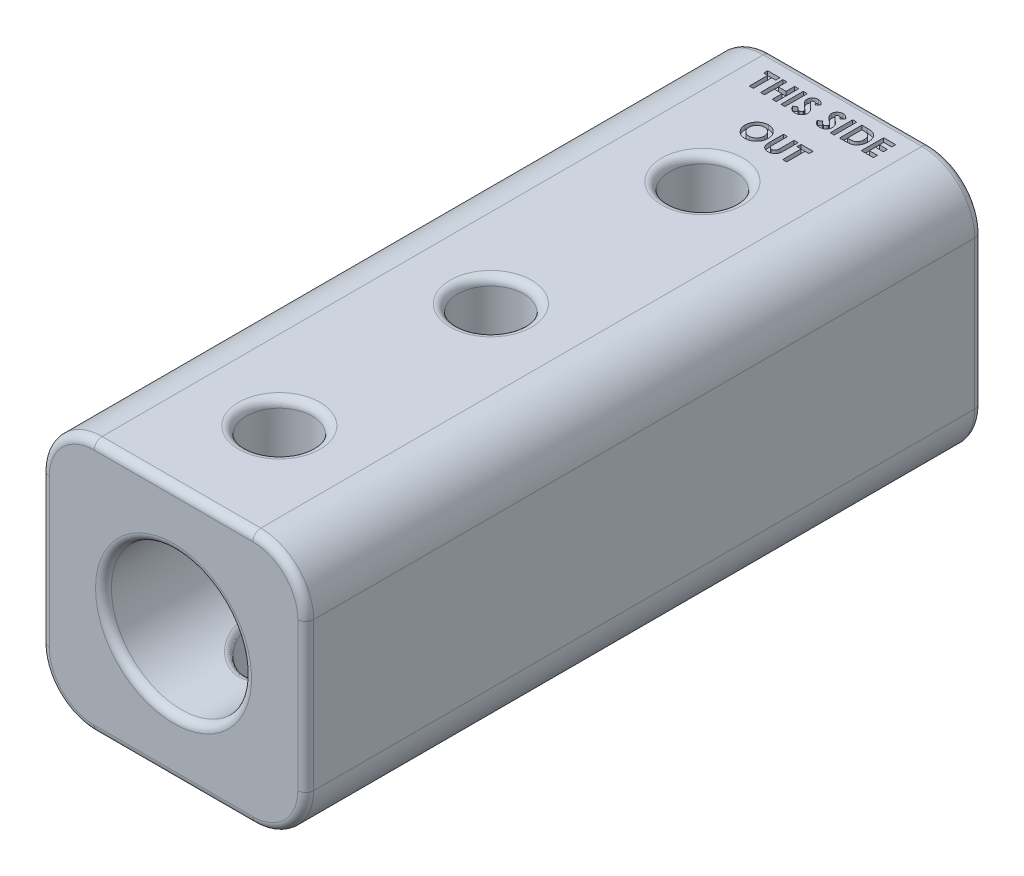
from build123d import *

# Parameters (mm, degrees)
SKETCH1_W           = 25
SKETCH1_H           = 24
SKETCH1_R           = 6.625
BOSS_EXTRUDE1_DEPTH = 32
SKETCH2_R           = 3.1
CUT_EXTRUDE1_DEPTH  = 42.907636536
FILLET1_R           = 5
FILLET2_R           = 0.75
SKETCH3_W           = 0.37991453
SKETCH3_H           = 2.116666666
CUT_EXTRUDE2_DEPTH  = 0.4


with BuildPart() as part:
    # Sketch1 → Boss-Extrude1 (new, symmetric)
    with BuildSketch(Plane.XY):
        Rectangle(SKETCH1_W, SKETCH1_H)
        Circle(SKETCH1_R, mode=Mode.SUBTRACT)
    extrude(amount=BOSS_EXTRUDE1_DEPTH, both=True)

    # Sketch2 → Cut-Extrude1 (cut, through all)
    with BuildSketch(Plane(origin=(0, 12, 0), x_dir=(1, 0, 0), z_dir=(0, 1, 0))):
        with Locations(Location((0, -22, 0), (0, 0, 270))):
            Circle(SKETCH2_R)
        with Locations(Location((0, -2, 0), (0, 0, 270))):
            Circle(SKETCH2_R)
        with Locations(Location((0, 18, 0), (0, 0, 270))):
            Circle(SKETCH2_R)
    extrude(amount=-CUT_EXTRUDE1_DEPTH, mode=Mode.SUBTRACT)

    # Fillet1
    fillet1_edges = [part.edges().sort_by_distance(p)[0] for p in [
        (12.5, -12, 0),
        (-12.5, -12, 0),
        (-12.5, 12, 0),
        (12.5, 12, 0),
    ]]
    fillet(fillet1_edges, radius=FILLET1_R)

    # Fillet2
    fillet2_edges = [part.edges().sort_by_distance(p)[0] for p in [
        (-6.625, 0, -32),
        (-6.625, 0, 32),
        (0, 6.625, 18.899999999),
        (0, -6.625, 18.899999999),
        (0, -12, 18.9),
        (0, 12, 18.9),
        (0, 6.625, -1.100000001),
        (0, -6.625, -1.100000001),
        (0, -12, -1.1),
        (0, 12, -1.1),
        (0, 6.625, -21.100000001),
        (0, -6.625, -21.100000001),
        (0, -12, -21.1),
        (0, 12, -21.1),
        (12.5, 0, -32),
        (12.5, 0, 32),
        (0, -12, -32),
        (-12.5, 0, -32),
        (0, 12, -32),
        (11.035533906, 10.535533906, -32),
        (-11.035533906, 10.535533906, -32),
        (-11.035533906, -10.535533906, -32),
        (11.035533906, -10.535533906, -32),
        (0, -12, 32),
        (0, 12, 32),
        (-12.5, 0, 32),
        (11.035533906, 10.535533906, 32),
        (-11.035533906, 10.535533906, 32),
        (-11.035533906, -10.535533906, 32),
        (11.035533906, -10.535533906, 32),
    ]]
    fillet(fillet2_edges, radius=FILLET2_R)

    # Sketch3 → Cut-Extrude2 (cut)
    # profile 1 of 11: a face of its own
    with BuildSketch(Plane(origin=(0, 12, 0), x_dir=(1, 0, 0), z_dir=(0, 1, 0))):
        Polygon((-5.97929219, 30.156200498), (-4.839548601, 30.156200498), (-4.839548601, 29.776285968), (-5.219463131, 29.776285968), (-5.219463131, 28.039533832), (-5.59937766, 28.039533832), (-5.59937766, 29.776285968), (-5.97929219, 29.776285968), align=None)
    # profile 2 of 11: a face of its own
    with BuildSketch(Plane(origin=(0, 12, 0), x_dir=(1, 0, 0), z_dir=(0, 1, 0))):
        Polygon((-4.541044327, 30.156200498), (-4.161129797, 30.156200498), (-4.161129797, 29.342097934), (-3.428437489, 29.342097934), (-3.428437489, 30.156200498), (-3.04852296, 30.156200498), (-3.04852296, 28.039533832), (-3.428437489, 28.039533832), (-3.428437489, 28.962183404), (-4.161129797, 28.962183404), (-4.161129797, 28.039533832), (-4.541044327, 28.039533832), align=None)
    # profile 3 of 11: a face of its own
    with BuildSketch(Plane(origin=(0, 12, 0), x_dir=(1, 0, 0), z_dir=(0, 1, 0))):
        with Locations((-2.42437766, 29.097867165)):
            Rectangle(SKETCH3_W, SKETCH3_H)
    # profile 4 of 11: a face of its own
    with BuildSketch(Plane(origin=(0, 12, 0), x_dir=(1, 0, 0), z_dir=(0, 1, 0))):
        with BuildLine():
            Line((-0.660488772, 29.87338466), (-0.944576645, 29.613465456))
            add(Edge.make_bspline(
                [(-0.944576645, 29.613465456), (-0.956745752, 29.630631245), (-0.980108739, 29.663587168), (-1.017977704, 29.707715924), (-1.055675672, 29.745361038), (-1.093551891, 29.776365244), (-1.131942081, 29.80054017), (-1.170779602, 29.817656284), (-1.209844274, 29.828537161), (-1.236089704, 29.829892092), (-1.249017084, 29.830559473)],
                knots=[0, 0, 0, 0, 1.299362458, 2.494594718, 3.587462134, 4.587049575, 5.512617175, 6.380583204, 7.202344345, 8, 8, 8, 8], degree=3))
            add(Edge.make_bspline(
                [(-1.249017084, 29.830559473), (-1.261075372, 29.830136589), (-1.28435676, 29.829320113), (-1.317546105, 29.821204396), (-1.347012078, 29.807197861), (-1.372725921, 29.788883138), (-1.39309508, 29.766818143), (-1.409358273, 29.743677636), (-1.418515817, 29.718135751), (-1.41972113, 29.700592553), (-1.420317831, 29.69190763)],
                knots=[0, 0, 0, 0, 1.185010067, 2.2879431, 3.333075148, 4.379039566, 5.372662701, 6.27520591, 7.14612461, 8, 8, 8, 8], degree=3))
            add(Edge.make_bspline(
                [(-1.420317831, 29.69190763), (-1.419943909, 29.683097466), (-1.419190881, 29.66535502), (-1.411917655, 29.639351256), (-1.400954827, 29.613942552), (-1.390479397, 29.598475064), (-1.385124856, 29.590568821)],
                knots=[0, 0, 0, 0, 0.967525499, 1.948461899, 2.951351359, 4, 4, 4, 4], degree=3))
            add(Edge.make_bspline(
                [(-1.385124856, 29.590568821), (-1.380256999, 29.584423381), (-1.369051835, 29.570277389), (-1.347685881, 29.547872343), (-1.320854731, 29.5204242), (-1.287525865, 29.488876822), (-1.249082856, 29.452095641), (-1.20374382, 29.411526541), (-1.152813814, 29.365913142), (-1.116613945, 29.334149623), (-1.097644888, 29.317505253)],
                knots=[0, 0, 0, 0, 0.473873513, 1.090794244, 1.870441696, 2.795289791, 3.865433203, 5.087734844, 6.473946851, 8, 8, 8, 8], degree=3))
            add(Edge.make_bspline(
                [(-1.097644888, 29.317505253), (-1.079839699, 29.30209576), (-1.046049151, 29.272851744), (-0.99797191, 29.23134456), (-0.955720022, 29.194001558), (-0.918677975, 29.161383177), (-0.887407288, 29.133147176), (-0.8617765, 29.109158587), (-0.841472575, 29.089884424), (-0.829930982, 29.078242817), (-0.825005331, 29.073274483)],
                knots=[0, 0, 0, 0, 1.543621617, 2.929473131, 4.163658386, 5.240097082, 6.164993805, 6.925417477, 7.541396219, 8, 8, 8, 8], degree=3))
            add(Edge.make_bspline(
                [(-0.825005331, 29.073274483), (-0.80631844, 29.053051265), (-0.770395672, 29.014175136), (-0.723708737, 28.953929363), (-0.685283879, 28.895117204), (-0.655557681, 28.836632013), (-0.63310726, 28.777629965), (-0.617279416, 28.716664039), (-0.607800015, 28.653097177), (-0.60674758, 28.609720554), (-0.606215267, 28.587781027)],
                knots=[0, 0, 0, 0, 1.206664779, 2.319633467, 3.337109185, 4.282041471, 5.190008762, 6.099243693, 7.03861361, 8, 8, 8, 8], degree=3))
            add(Edge.make_bspline(
                [(-0.606215267, 28.587781027), (-0.606594154, 28.566403649), (-0.607337543, 28.524460436), (-0.616442637, 28.463082792), (-0.629425967, 28.404341723), (-0.649500473, 28.348876415), (-0.673967162, 28.295776421), (-0.70463969, 28.245868871), (-0.740660369, 28.19864868), (-0.781945597, 28.154959966), (-0.827611962, 28.115315486), (-0.876593478, 28.080023034), (-0.929369112, 28.05088462), (-0.985487956, 28.026891214), (-1.044919972, 28.008411172), (-1.107594359, 27.994752698), (-1.17360698, 27.986555098), (-1.218747361, 27.985698136), (-1.241808884, 27.985260327)],
                knots=[0, 0, 0, 0, 1.043214005, 2.046824704, 3.02475056, 3.976699089, 4.921714032, 5.875962561, 6.831408892, 7.817874052, 8.806269674, 9.781291748, 10.760897367, 11.74438705, 12.757449933, 13.795994037, 14.874007457, 16, 16, 16, 16], degree=3))
            add(Edge.make_bspline(
                [(-1.241808884, 27.985260327), (-1.259911982, 27.985581488), (-1.2957665, 27.986217571), (-1.348610639, 27.99141066), (-1.399637628, 27.999791752), (-1.448789991, 28.011804361), (-1.496289168, 28.027025966), (-1.542137109, 28.045618573), (-1.58601731, 28.067870361), (-1.628261791, 28.093323744), (-1.668665191, 28.122878475), (-1.707738395, 28.155930317), (-1.745093291, 28.192987621), (-1.780909287, 28.23396275), (-1.814957222, 28.278971733), (-1.848351607, 28.327387739), (-1.879608295, 28.380109303), (-1.898916942, 28.417093906), (-1.90877937, 28.43598482)],
                knots=[0, 0, 0, 0, 1.016823716, 2.013894106, 2.979844003, 3.91962641, 4.853723003, 5.779685073, 6.695824784, 7.614987388, 8.547259901, 9.504950863, 10.487499108, 11.500346958, 12.559593716, 13.656357062, 14.802919212, 16, 16, 16, 16], degree=3))
            Line((-1.90877937, 28.43598482), (-1.574658109, 28.636542379))
            add(Edge.make_bspline(
                [(-1.574658109, 28.636542379), (-1.562321686, 28.615098723), (-1.538671707, 28.573989402), (-1.498594608, 28.518753818), (-1.457537666, 28.471453684), (-1.414551681, 28.432925033), (-1.370159347, 28.402652686), (-1.324146239, 28.381017966), (-1.276480028, 28.3676261), (-1.24401197, 28.365990643), (-1.227816496, 28.365174857)],
                knots=[0, 0, 0, 0, 1.283663364, 2.460892379, 3.537111102, 4.529833553, 5.449777664, 6.316464042, 7.160231139, 8, 8, 8, 8], degree=3))
            add(Edge.make_bspline(
                [(-1.227816496, 28.365174857), (-1.21134338, 28.365841072), (-1.179383135, 28.367133627), (-1.133763976, 28.379072563), (-1.091938604, 28.397817567), (-1.055785061, 28.424564104), (-1.02517252, 28.455433673), (-1.002578707, 28.48977748), (-0.988385122, 28.52693665), (-0.986884516, 28.552749854), (-0.986129797, 28.565732416)],
                knots=[0, 0, 0, 0, 1.13588714, 2.203786484, 3.234766741, 4.283437687, 5.291419208, 6.222934724, 7.106237994, 8, 8, 8, 8], degree=3))
            add(Edge.make_bspline(
                [(-0.986129797, 28.565732416), (-0.986826749, 28.577810578), (-0.98824254, 28.602346207), (-0.998670822, 28.638826742), (-1.014973408, 28.675290686), (-1.034260516, 28.7051994), (-1.053887564, 28.730241155), (-1.072655448, 28.751938703), (-1.095509767, 28.775910695), (-1.122392571, 28.802187286), (-1.152948669, 28.830999796), (-1.1872038, 28.862345403), (-1.225550222, 28.895947989), (-1.252653549, 28.918837739), (-1.266825577, 28.930806535)],
                knots=[0, 0, 0, 0, 0.916159276, 1.861089862, 2.860218735, 3.940849679, 4.552606315, 5.27541173, 6.11797699, 7.06649574, 8.129236253, 9.306560635, 10.591630461, 12, 12, 12, 12], degree=3))
            add(Edge.make_bspline(
                [(-1.266825577, 28.930806535), (-1.293767167, 28.953601704), (-1.345476234, 28.997352532), (-1.418547705, 29.061971129), (-1.484391644, 29.122363129), (-1.54243935, 29.179275108), (-1.593430443, 29.231656036), (-1.637019587, 29.279931368), (-1.672727936, 29.324473485), (-1.710303274, 29.377230641), (-1.746007358, 29.441518861), (-1.776865818, 29.518865042), (-1.796885485, 29.59620141), (-1.79912841, 29.648120787), (-1.800232361, 29.673675124)],
                knots=[0, 0, 0, 0, 1.345494975, 2.582412109, 3.71882943, 4.751509156, 5.681369928, 6.505683931, 7.230279997, 7.856715994, 8.973648664, 10.023341002, 11.027102913, 12, 12, 12, 12], degree=3))
            add(Edge.make_bspline(
                [(-1.800232361, 29.673675124), (-1.799773229, 29.691796889), (-1.79886869, 29.727498712), (-1.790800061, 29.77999304), (-1.778741188, 29.830645656), (-1.761228242, 29.879271756), (-1.738498553, 29.925810434), (-1.710894228, 29.970489516), (-1.677986625, 30.012897786), (-1.640901978, 30.05300713), (-1.600044191, 30.089662507), (-1.556382454, 30.122014549), (-1.510163896, 30.149339555), (-1.461671257, 30.172007631), (-1.410604051, 30.189358603), (-1.357338486, 30.201657837), (-1.301798163, 30.208973029), (-1.264020834, 30.209967445), (-1.244776966, 30.210474003)],
                knots=[0, 0, 0, 0, 1.010766082, 1.991317756, 2.957454644, 3.913069143, 4.869106762, 5.843196583, 6.838735724, 7.860187025, 8.887984031, 9.89767229, 10.887916223, 11.879572884, 12.879850636, 13.892031539, 14.926195476, 16, 16, 16, 16], degree=3))
            add(Edge.make_bspline(
                [(-1.244776966, 30.210474003), (-1.219837866, 30.209561677), (-1.170156525, 30.207744228), (-1.096701231, 30.193532368), (-1.02495317, 30.171182722), (-0.967137238, 30.144220333), (-0.92113418, 30.118101854), (-0.885877134, 30.094055249), (-0.850001191, 30.06650857), (-0.813217035, 30.035375011), (-0.776208173, 30.000067974), (-0.737922264, 29.961427972), (-0.698881003, 29.919121063), (-0.673510373, 29.888897204), (-0.660488772, 29.87338466)],
                knots=[0, 0, 0, 0, 1.282922637, 2.555718331, 3.837320111, 5.142675274, 5.830281639, 6.55870424, 7.337177975, 8.157850921, 9.037902056, 9.96903443, 10.957596896, 12, 12, 12, 12], degree=3))
        make_face()
    # profile 5 of 11: a face of its own
    with BuildSketch(Plane(origin=(0, 12, 0), x_dir=(1, 0, 0), z_dir=(0, 1, 0))):
        with BuildLine():
            Line((1.673271912, 29.87338466), (1.389184038, 29.613465456))
            add(Edge.make_bspline(
                [(1.389184038, 29.613465456), (1.377014932, 29.630631245), (1.353651945, 29.663587168), (1.315782979, 29.707715924), (1.278085012, 29.745361038), (1.240208793, 29.776365244), (1.201818603, 29.80054017), (1.162981082, 29.817656284), (1.123916409, 29.828537161), (1.09767098, 29.829892092), (1.0847436, 29.830559473)],
                knots=[0, 0, 0, 0, 1.299362458, 2.494594718, 3.587462134, 4.587049575, 5.512617175, 6.380583204, 7.202344345, 8, 8, 8, 8], degree=3))
            add(Edge.make_bspline(
                [(1.0847436, 29.830559473), (1.072685312, 29.830136589), (1.049403924, 29.829320113), (1.016214579, 29.821204396), (0.986748606, 29.807197861), (0.961034762, 29.788883138), (0.940665604, 29.766818143), (0.924402411, 29.743677636), (0.915244867, 29.718135751), (0.914039554, 29.700592553), (0.913442852, 29.69190763)],
                knots=[0, 0, 0, 0, 1.185010067, 2.2879431, 3.333075148, 4.379039566, 5.372662701, 6.27520591, 7.14612461, 8, 8, 8, 8], degree=3))
            add(Edge.make_bspline(
                [(0.913442852, 29.69190763), (0.913816775, 29.683097466), (0.914569803, 29.66535502), (0.921843029, 29.639351256), (0.932805857, 29.613942552), (0.943281287, 29.598475064), (0.948635828, 29.590568821)],
                knots=[0, 0, 0, 0, 0.967525499, 1.948461899, 2.951351359, 4, 4, 4, 4], degree=3))
            add(Edge.make_bspline(
                [(0.948635828, 29.590568821), (0.953503685, 29.584423381), (0.964708849, 29.570277389), (0.986074803, 29.547872343), (1.012905953, 29.5204242), (1.046234819, 29.488876822), (1.084677828, 29.452095641), (1.130016864, 29.411526541), (1.18094687, 29.365913142), (1.217146739, 29.334149623), (1.236115796, 29.317505253)],
                knots=[0, 0, 0, 0, 0.473873513, 1.090794244, 1.870441696, 2.795289791, 3.865433203, 5.087734844, 6.473946851, 8, 8, 8, 8], degree=3))
            add(Edge.make_bspline(
                [(1.236115796, 29.317505253), (1.253920984, 29.30209576), (1.287711533, 29.272851744), (1.335788774, 29.23134456), (1.378040662, 29.194001558), (1.415082709, 29.161383177), (1.446353396, 29.133147176), (1.471984184, 29.109158587), (1.492288109, 29.089884424), (1.503829702, 29.078242817), (1.508755352, 29.073274483)],
                knots=[0, 0, 0, 0, 1.543621617, 2.929473131, 4.163658386, 5.240097082, 6.164993805, 6.925417477, 7.541396219, 8, 8, 8, 8], degree=3))
            add(Edge.make_bspline(
                [(1.508755352, 29.073274483), (1.527442244, 29.053051265), (1.563365012, 29.014175136), (1.610051947, 28.953929363), (1.648476805, 28.895117204), (1.678203003, 28.836632013), (1.700653424, 28.777629965), (1.716481268, 28.716664039), (1.725960669, 28.653097177), (1.727013104, 28.609720554), (1.727545416, 28.587781027)],
                knots=[0, 0, 0, 0, 1.206664779, 2.319633467, 3.337109185, 4.282041471, 5.190008762, 6.099243693, 7.03861361, 8, 8, 8, 8], degree=3))
            add(Edge.make_bspline(
                [(1.727545416, 28.587781027), (1.72716653, 28.566403649), (1.726423141, 28.524460436), (1.717318046, 28.463082792), (1.704334716, 28.404341723), (1.684260211, 28.348876415), (1.659793522, 28.295776421), (1.629120994, 28.245868871), (1.593100315, 28.19864868), (1.551815087, 28.154959966), (1.506148722, 28.115315486), (1.457167206, 28.080023034), (1.404391572, 28.05088462), (1.348272727, 28.026891214), (1.288840711, 28.008411172), (1.226166325, 27.994752698), (1.160153704, 27.986555098), (1.115013322, 27.985698136), (1.0919518, 27.985260327)],
                knots=[0, 0, 0, 0, 1.043214005, 2.046824704, 3.02475056, 3.976699089, 4.921714032, 5.875962561, 6.831408892, 7.817874052, 8.806269674, 9.781291748, 10.760897367, 11.74438705, 12.757449933, 13.795994037, 14.874007457, 16, 16, 16, 16], degree=3))
            add(Edge.make_bspline(
                [(1.0919518, 27.985260327), (1.073848701, 27.985581488), (1.037994184, 27.986217571), (0.985150045, 27.99141066), (0.934123056, 27.999791752), (0.884970693, 28.011804361), (0.837471516, 28.027025966), (0.791623575, 28.045618573), (0.747743373, 28.067870361), (0.705498892, 28.093323744), (0.665095492, 28.122878475), (0.626022288, 28.155930317), (0.588667393, 28.192987621), (0.552851397, 28.23396275), (0.518803462, 28.278971733), (0.485409077, 28.327387739), (0.454152389, 28.380109303), (0.434843742, 28.417093906), (0.424981314, 28.43598482)],
                knots=[0, 0, 0, 0, 1.016823716, 2.013894106, 2.979844003, 3.91962641, 4.853723003, 5.779685073, 6.695824784, 7.614987388, 8.547259901, 9.504950863, 10.487499108, 11.500346958, 12.559593716, 13.656357062, 14.802919212, 16, 16, 16, 16], degree=3))
            Line((0.424981314, 28.43598482), (0.759102575, 28.636542379))
            add(Edge.make_bspline(
                [(0.759102575, 28.636542379), (0.771438998, 28.615098723), (0.795088977, 28.573989402), (0.835166076, 28.518753818), (0.876223018, 28.471453684), (0.919209003, 28.432925033), (0.963601337, 28.402652686), (1.009614445, 28.381017966), (1.057280656, 28.3676261), (1.089748713, 28.365990643), (1.105944188, 28.365174857)],
                knots=[0, 0, 0, 0, 1.283663364, 2.460892379, 3.537111102, 4.529833553, 5.449777664, 6.316464042, 7.160231139, 8, 8, 8, 8], degree=3))
            add(Edge.make_bspline(
                [(1.105944188, 28.365174857), (1.122417304, 28.365841072), (1.154377548, 28.367133627), (1.199996708, 28.379072563), (1.24182208, 28.397817567), (1.277975623, 28.424564104), (1.308588164, 28.455433673), (1.331181976, 28.48977748), (1.345375562, 28.52693665), (1.346876168, 28.552749854), (1.347630887, 28.565732416)],
                knots=[0, 0, 0, 0, 1.13588714, 2.203786484, 3.234766741, 4.283437687, 5.291419208, 6.222934724, 7.106237994, 8, 8, 8, 8], degree=3))
            add(Edge.make_bspline(
                [(1.347630887, 28.565732416), (1.346933935, 28.577810578), (1.345518143, 28.602346207), (1.335089861, 28.638826742), (1.318787276, 28.675290686), (1.299500168, 28.7051994), (1.27987312, 28.730241155), (1.261105235, 28.751938703), (1.238250917, 28.775910695), (1.211368113, 28.802187286), (1.180812015, 28.830999796), (1.146556884, 28.862345403), (1.108210462, 28.895947989), (1.081107135, 28.918837739), (1.066935107, 28.930806535)],
                knots=[0, 0, 0, 0, 0.916159276, 1.861089862, 2.860218735, 3.940849679, 4.552606315, 5.27541173, 6.11797699, 7.06649574, 8.129236253, 9.306560635, 10.591630461, 12, 12, 12, 12], degree=3))
            add(Edge.make_bspline(
                [(1.066935107, 28.930806535), (1.039993516, 28.953601704), (0.98828445, 28.997352532), (0.915212978, 29.061971129), (0.84936904, 29.122363129), (0.791321333, 29.179275108), (0.740330241, 29.231656036), (0.696741097, 29.279931368), (0.661032748, 29.324473485), (0.62345741, 29.377230641), (0.587753326, 29.441518861), (0.556894866, 29.518865042), (0.536875199, 29.59620141), (0.534632274, 29.648120787), (0.533528322, 29.673675124)],
                knots=[0, 0, 0, 0, 1.345494975, 2.582412109, 3.71882943, 4.751509156, 5.681369928, 6.505683931, 7.230279997, 7.856715994, 8.973648664, 10.023341002, 11.027102913, 12, 12, 12, 12], degree=3))
            add(Edge.make_bspline(
                [(0.533528322, 29.673675124), (0.533987454, 29.691796889), (0.534891994, 29.727498712), (0.542960622, 29.77999304), (0.555019496, 29.830645656), (0.572532442, 29.879271756), (0.595262131, 29.925810434), (0.622866456, 29.970489516), (0.655774059, 30.012897786), (0.692858706, 30.05300713), (0.733716493, 30.089662507), (0.77737823, 30.122014549), (0.823596788, 30.149339555), (0.872089426, 30.172007631), (0.923156633, 30.189358603), (0.976422198, 30.201657837), (1.031962521, 30.208973029), (1.06973985, 30.209967445), (1.088983718, 30.210474003)],
                knots=[0, 0, 0, 0, 1.010766082, 1.991317756, 2.957454644, 3.913069143, 4.869106762, 5.843196583, 6.838735724, 7.860187025, 8.887984031, 9.89767229, 10.887916223, 11.879572884, 12.879850636, 13.892031539, 14.926195476, 16, 16, 16, 16], degree=3))
            add(Edge.make_bspline(
                [(1.088983718, 30.210474003), (1.113922818, 30.209561677), (1.163604159, 30.207744228), (1.237059453, 30.193532368), (1.308807514, 30.171182722), (1.366623446, 30.144220333), (1.412626504, 30.118101854), (1.44788355, 30.094055249), (1.483759493, 30.06650857), (1.520543649, 30.035375011), (1.557552511, 30.000067974), (1.59583842, 29.961427972), (1.634879681, 29.919121063), (1.660250311, 29.888897204), (1.673271912, 29.87338466)],
                knots=[0, 0, 0, 0, 1.282922637, 2.555718331, 3.837320111, 5.142675274, 5.830281639, 6.55870424, 7.337177975, 8.157850921, 9.037902056, 9.96903443, 10.957596896, 12, 12, 12, 12], degree=3))
        make_face()
    # profile 6 of 11: a face of its own
    with BuildSketch(Plane(origin=(0, 12, 0), x_dir=(1, 0, 0), z_dir=(0, 1, 0))):
        with Locations((2.243143707, 29.097867165)):
            Rectangle(SKETCH3_W, SKETCH3_H)
    # profile 7 of 11: a face of its own
    with BuildSketch(Plane(origin=(0, 12, 0), x_dir=(1, 0, 0), z_dir=(0, 1, 0))):
        with BuildLine():
            Line((2.921562511, 30.156200498), (3.400271779, 30.156200498))
            add(Edge.make_bspline(
                [(3.400271779, 30.156200498), (3.437592672, 30.155939613), (3.509734382, 30.155435317), (3.614253446, 30.149753123), (3.711442876, 30.141014311), (3.801365321, 30.128992491), (3.883836426, 30.113084332), (3.958749846, 30.093130665), (4.026357009, 30.070097475), (4.087399213, 30.042994253), (4.143124873, 30.011394588), (4.196038167, 29.976195098), (4.246035198, 29.936106323), (4.293817598, 29.891901656), (4.338768724, 29.842772385), (4.381637173, 29.789532269), (4.42137333, 29.731409254), (4.459178336, 29.669796945), (4.493367932, 29.604434235), (4.523189376, 29.53587748), (4.54817098, 29.464567865), (4.568469827, 29.390429395), (4.58465035, 29.313708187), (4.595971537, 29.234249423), (4.602970407, 29.15212667), (4.603680384, 29.096468048), (4.604041143, 29.068186342)],
                knots=[0, 0, 0, 0, 1.44355588, 2.790409838, 4.047694926, 5.217575253, 6.298404546, 7.294384826, 8.214239204, 9.058592145, 9.873746385, 10.689560431, 11.514393297, 12.350027578, 13.205127629, 14.088021785, 14.991911688, 15.926770944, 16.882954281, 17.842803888, 18.816321264, 19.80318086, 20.814351908, 21.847355356, 22.906180909, 24, 24, 24, 24], degree=3))
            add(Edge.make_bspline(
                [(4.604041143, 29.068186342), (4.603096481, 29.028279014), (4.601236858, 28.949719103), (4.585572434, 28.834433337), (4.560237756, 28.723920433), (4.524614898, 28.619044864), (4.480452091, 28.520740563), (4.427694672, 28.430741086), (4.367116188, 28.349529503), (4.299422382, 28.277510182), (4.226126477, 28.2156086), (4.149957252, 28.162594424), (4.070172679, 28.120788323), (3.99987132, 28.094277003), (3.938911271, 28.077789256), (3.885389008, 28.068044839), (3.824593178, 28.05910862), (3.755956912, 28.052202903), (3.679781305, 28.0460447), (3.595762717, 28.042698573), (3.504173178, 28.039918437), (3.440555584, 28.039665393), (3.407479978, 28.039533832)],
                knots=[0, 0, 0, 0, 1.315458931, 2.589557908, 3.828601765, 5.048913369, 6.235739168, 7.376350998, 8.481830359, 9.569842114, 10.627874879, 11.640079404, 12.624025415, 13.590060155, 14.111227486, 14.704434459, 15.382649715, 16.137166398, 16.978595427, 17.902333227, 18.909396075, 20, 20, 20, 20], degree=3))
            Line((3.407479978, 28.039533832), (2.921562511, 28.039533832))
            Line((2.921562511, 28.039533832), (2.921562511, 30.156200498))
        make_face()
        with BuildLine():
            Line((3.30147704, 29.776285968), (3.30147704, 28.419448362))
            Line((3.30147704, 28.419448362), (3.49991454, 28.419448362))
            add(Edge.make_bspline(
                [(3.49991454, 28.419448362), (3.523525555, 28.419491627), (3.568937397, 28.41957484), (3.634501818, 28.423538361), (3.695132282, 28.427516643), (3.750661889, 28.435067556), (3.801494766, 28.443478741), (3.846932602, 28.455184057), (3.887912069, 28.4674795), (3.92393261, 28.483133123), (3.95692449, 28.500752317), (3.987471203, 28.521395246), (4.016957333, 28.54431844), (4.044831614, 28.570196103), (4.071199543, 28.598685565), (4.09590511, 28.629933621), (4.11927807, 28.663844932), (4.140718483, 28.700598795), (4.160310846, 28.739807082), (4.177691469, 28.781090002), (4.192102569, 28.824791354), (4.204080194, 28.87050204), (4.212639565, 28.918620024), (4.219720811, 28.968788903), (4.2233714, 29.02120744), (4.223872421, 29.056874766), (4.224126613, 29.07497053)],
                knots=[0, 0, 0, 0, 1.50275155, 2.890291501, 4.180787663, 5.369391935, 6.45668281, 7.458360028, 8.354766181, 9.177074746, 9.954075863, 10.732690366, 11.5210699, 12.329727389, 13.151100085, 13.990027547, 14.863562427, 15.770965086, 16.696477834, 17.652329173, 18.619756807, 19.62365428, 20.657822005, 21.729286259, 22.847956731, 24, 24, 24, 24], degree=3))
            add(Edge.make_bspline(
                [(4.224126613, 29.07497053), (4.223620349, 29.102700579), (4.222633173, 29.156772026), (4.21311306, 29.235528268), (4.197616132, 29.309689069), (4.175503509, 29.378979197), (4.147629862, 29.443593394), (4.112739496, 29.502984241), (4.072333957, 29.558149422), (4.040382359, 29.590511087), (4.024417078, 29.606681268)],
                knots=[0, 0, 0, 0, 1.13821349, 2.219428113, 3.251817212, 4.244760574, 5.201143372, 6.134805572, 7.068016741, 8, 8, 8, 8], degree=3))
            add(Edge.make_bspline(
                [(4.024417078, 29.606681268), (4.008673798, 29.620460447), (3.976519933, 29.648602862), (3.920068312, 29.682324671), (3.857861549, 29.711952586), (3.78847654, 29.735444218), (3.71258386, 29.754022402), (3.629731492, 29.766835321), (3.540363127, 29.775068768), (3.478450806, 29.775871542), (3.44648906, 29.776285968)],
                knots=[0, 0, 0, 0, 0.813307809, 1.661089106, 2.549956539, 3.493439533, 4.508053171, 5.589449661, 6.755572447, 8, 8, 8, 8], degree=3))
            Line((3.44648906, 29.776285968), (3.30147704, 29.776285968))
        make_face(mode=Mode.SUBTRACT)
    # profile 8 of 11: a face of its own
    with BuildSketch(Plane(origin=(0, 12, 0), x_dir=(1, 0, 0), z_dir=(0, 1, 0))):
        Polygon((4.983955673, 30.156200498), (6.123699263, 30.156200498), (6.123699263, 29.776285968), (5.363870203, 29.776285968), (5.363870203, 29.369234686), (6.123699263, 29.369234686), (6.123699263, 28.989320156), (5.363870203, 28.989320156), (5.363870203, 28.419448362), (6.123699263, 28.419448362), (6.123699263, 28.039533832), (4.983955673, 28.039533832), align=None)
    # profile 9 of 11: a face of its own
    with BuildSketch(Plane(origin=(0, 12, 0), x_dir=(1, 0, 0), z_dir=(0, 1, 0))):
        with BuildLine():
            add(Edge.make_bspline(
                [(-1.511056346, 25.764106481), (-1.474255502, 25.763153641), (-1.401602301, 25.76127252), (-1.294755659, 25.745591904), (-1.191789164, 25.720042589), (-1.092749377, 25.684527192), (-0.997884281, 25.638083778), (-0.906859257, 25.582029046), (-0.820000351, 25.515304997), (-0.738197623, 25.439468194), (-0.66259715, 25.356998982), (-0.597089295, 25.268206214), (-0.5412266, 25.175390598), (-0.494927449, 25.078303434), (-0.459662028, 24.976272346), (-0.434914823, 24.869817558), (-0.41901597, 24.758969355), (-0.417187358, 24.683496838), (-0.416258002, 24.645139467)],
                knots=[0, 0, 0, 0, 1.014329547, 2.002516266, 2.970391464, 3.935626869, 4.897733899, 5.877609409, 6.878433252, 7.912639331, 8.949961323, 9.958554974, 10.949718813, 11.932905612, 12.9188844, 13.919928257, 14.942845884, 16, 16, 16, 16], degree=3))
            add(Edge.make_bspline(
                [(-0.416258002, 24.645139467), (-0.417247725, 24.607214296), (-0.419198006, 24.532481529), (-0.434265762, 24.422654836), (-0.459429713, 24.3173404), (-0.494097005, 24.21629984), (-0.539556465, 24.120022562), (-0.594329777, 24.027893849), (-0.659862304, 23.940768677), (-0.733763818, 23.8586938), (-0.815122972, 23.784193238), (-0.901295232, 23.718539747), (-0.991882707, 23.662907456), (-1.086752806, 23.617321848), (-1.186108974, 23.581944536), (-1.289705789, 23.556983272), (-1.39753684, 23.541813807), (-1.470867184, 23.539876265), (-1.508088264, 23.538892806)],
                knots=[0, 0, 0, 0, 1.051557043, 2.072126891, 3.067553643, 4.050577992, 5.02905126, 6.015227836, 7.017913613, 8.04756643, 9.074058332, 10.072836633, 11.047628519, 12.017157415, 12.98668631, 13.966869689, 14.968021931, 16, 16, 16, 16], degree=3))
            add(Edge.make_bspline(
                [(-1.508088264, 23.538892806), (-1.547017051, 23.539775017), (-1.623506797, 23.541508442), (-1.735449881, 23.557992522), (-1.842701029, 23.582823304), (-1.944359269, 23.619881914), (-2.041459903, 23.666208293), (-2.133289504, 23.723262006), (-2.219817211, 23.790948767), (-2.300546688, 23.867535094), (-2.373687789, 23.951337333), (-2.438249157, 24.039866968), (-2.492708104, 24.132447709), (-2.537066621, 24.229122886), (-2.572037094, 24.329291687), (-2.596704789, 24.433564168), (-2.611276586, 24.541690246), (-2.613306352, 24.61513164), (-2.614334925, 24.652347667)],
                knots=[0, 0, 0, 0, 1.067978421, 2.098431617, 3.099715153, 4.085208694, 5.062210972, 6.048429807, 7.046490867, 8.072918869, 9.098532598, 10.095778865, 11.076610158, 12.041847152, 13.011192615, 13.984257998, 14.978533688, 16, 16, 16, 16], degree=3))
            add(Edge.make_bspline(
                [(-2.614334925, 24.652347667), (-2.6140121, 24.677384662), (-2.613370537, 24.727141626), (-2.60564223, 24.800878907), (-2.594515691, 24.873176936), (-2.578060068, 24.943747458), (-2.558070692, 25.013088317), (-2.532171631, 25.08055407), (-2.50269149, 25.146865437), (-2.468246722, 25.211239197), (-2.429947471, 25.27308306), (-2.388159577, 25.332105295), (-2.342777967, 25.387592238), (-2.293948829, 25.439908527), (-2.241503892, 25.488710282), (-2.186133014, 25.534688361), (-2.126762322, 25.576621422), (-2.064691256, 25.615533554), (-2.000269758, 25.65072112), (-1.93376008, 25.680671724), (-1.866532455, 25.706827076), (-1.797688811, 25.727470037), (-1.727966932, 25.744283512), (-1.656621978, 25.755402552), (-1.584298513, 25.763130644), (-1.535528341, 25.76378043), (-1.511056346, 25.764106481)],
                knots=[0, 0, 0, 0, 1.034744296, 2.056386356, 3.06226378, 4.057406941, 5.050368692, 6.043467995, 7.042652155, 8.049140477, 9.059438543, 10.048523776, 11.036952808, 12.020949711, 13.004946614, 13.997082645, 14.994316842, 16.007702937, 17.024872941, 18.026463647, 19.021641123, 20.005082605, 20.995858141, 21.984425357, 22.988620895, 24, 24, 24, 24], degree=3))
        make_face()
        with BuildLine():
            add(Edge.make_bspline(
                [(-1.516992511, 25.384191951), (-1.541759474, 25.383527398), (-1.590639549, 25.382215836), (-1.662337716, 25.372223506), (-1.731170489, 25.35626462), (-1.7967563, 25.333148368), (-1.859379403, 25.303727247), (-1.919150811, 25.268104057), (-1.975242812, 25.22505429), (-2.02840334, 25.176889098), (-2.076425128, 25.123222004), (-2.118853894, 25.065708586), (-2.154359936, 25.004444891), (-2.18409647, 24.940000043), (-2.206481488, 24.871649377), (-2.222425666, 24.799928291), (-2.232501792, 24.724713207), (-2.2337719, 24.673439182), (-2.234420395, 24.647259526)],
                knots=[0, 0, 0, 0, 1.033739768, 2.040188636, 3.016340934, 3.979330865, 4.937572243, 5.900995986, 6.878200029, 7.884839167, 8.891893314, 9.879764717, 10.863503415, 11.843163062, 12.837761627, 13.859916423, 14.907309254, 16, 16, 16, 16], degree=3))
            add(Edge.make_bspline(
                [(-2.234420395, 24.647259526), (-2.233560589, 24.618246578), (-2.231875511, 24.561386007), (-2.220019095, 24.478439337), (-2.199733947, 24.40010444), (-2.170442588, 24.32676444), (-2.134113619, 24.257604951), (-2.088998804, 24.193473621), (-2.035828792, 24.133986462), (-1.994867045, 24.09925538), (-1.97407718, 24.081627849)],
                knots=[0, 0, 0, 0, 1.078454662, 2.113592447, 3.107694534, 4.079536787, 5.043276885, 6.005368276, 6.987637804, 8, 8, 8, 8], degree=3))
            add(Edge.make_bspline(
                [(-1.97407718, 24.081627849), (-1.957046311, 24.068605305), (-1.923368283, 24.042853619), (-1.869610817, 24.009847549), (-1.814251212, 23.981558056), (-1.756871712, 23.958700479), (-1.697593497, 23.940721094), (-1.636424698, 23.928130426), (-1.573451985, 23.920228693), (-1.530866885, 23.919284286), (-1.509360299, 23.918807336)],
                knots=[0, 0, 0, 0, 1.023928204, 2.024787132, 3.009472467, 3.9914905, 4.972207045, 5.96565515, 6.972602802, 8, 8, 8, 8], degree=3))
            add(Edge.make_bspline(
                [(-1.509360299, 23.918807336), (-1.485019205, 23.919477524), (-1.437127335, 23.92079614), (-1.366763868, 23.930665458), (-1.299353529, 23.947367909), (-1.23447783, 23.970281376), (-1.172323842, 24.000071905), (-1.11319533, 24.036800015), (-1.056988625, 24.080014732), (-1.003895823, 24.128812439), (-0.955366493, 24.182690944), (-0.913026268, 24.240511132), (-0.87639131, 24.300999052), (-0.847273149, 24.365010819), (-0.824003748, 24.431942192), (-0.808251467, 24.502089594), (-0.798090221, 24.575163852), (-0.796819755, 24.624893467), (-0.796172532, 24.650227608)],
                knots=[0, 0, 0, 0, 1.026359118, 2.019393844, 2.989460624, 3.950973911, 4.916101784, 5.890408035, 6.881132271, 7.902007068, 8.92769091, 9.933912415, 10.920395702, 11.90457117, 12.894218921, 13.903490204, 14.931958862, 16, 16, 16, 16], degree=3))
            add(Edge.make_bspline(
                [(-0.796172532, 24.650227608), (-0.79684215, 24.675416071), (-0.798160189, 24.724995718), (-0.808046878, 24.797882103), (-0.824643406, 24.867719825), (-0.84762568, 24.934622937), (-0.876972828, 24.998657029), (-0.913263553, 25.059596918), (-0.956370516, 25.117383691), (-1.005301613, 25.171623554), (-1.058560104, 25.221466513), (-1.115738417, 25.264721141), (-1.175236636, 25.302308037), (-1.238419942, 25.331752094), (-1.303995658, 25.355210112), (-1.372363929, 25.372484932), (-1.443783705, 25.382145639), (-1.492372055, 25.383503767), (-1.516992511, 25.384191951)],
                knots=[0, 0, 0, 0, 1.055025985, 2.07665775, 3.074803781, 4.057872707, 5.035505728, 6.020516407, 7.023567878, 8.050795229, 9.077271434, 10.074415901, 11.050397877, 12.019801805, 12.988065821, 13.964604439, 14.968634123, 16, 16, 16, 16], degree=3))
        make_face(mode=Mode.SUBTRACT)
    # profile 10 of 11: a face of its own
    with BuildSketch(Plane(origin=(0, 12, 0), x_dir=(1, 0, 0), z_dir=(0, 1, 0))):
        with BuildLine():
            Line((-0.036343472, 25.709832977), (0.343571058, 25.709832977))
            Line((0.343571058, 25.709832977), (0.343571058, 24.332642806))
            add(Edge.make_bspline(
                [(0.343571058, 24.332642806), (0.343591715, 24.318364696), (0.343631616, 24.290786673), (0.345629055, 24.25122124), (0.347456849, 24.214852322), (0.350754708, 24.181719737), (0.355626777, 24.151809311), (0.36034453, 24.12492891), (0.366729541, 24.101559798), (0.376325193, 24.07495963), (0.391108941, 24.045072889), (0.415264767, 24.013924241), (0.443138523, 23.985496579), (0.476546825, 23.96183447), (0.514094801, 23.942693957), (0.555576144, 23.928512955), (0.600932378, 23.920630201), (0.632293725, 23.919426754), (0.648435507, 23.918807336)],
                knots=[0, 0, 0, 0, 1.155499968, 2.231836252, 3.205919964, 4.102923608, 4.924856345, 5.658536265, 6.31071849, 6.882491295, 7.94666036, 8.992281882, 10.060072772, 11.158554251, 12.289267114, 13.461410017, 14.693379945, 16, 16, 16, 16], degree=3))
            add(Edge.make_bspline(
                [(0.648435507, 23.918807336), (0.665584159, 23.919307746), (0.699021125, 23.920283461), (0.747114879, 23.929861159), (0.791674014, 23.945112134), (0.831755063, 23.966879161), (0.867318137, 23.992970759), (0.897421534, 24.022723357), (0.921179025, 24.056196297), (0.936663273, 24.087077632), (0.945356916, 24.115501212), (0.951873234, 24.140896603), (0.956650417, 24.17086065), (0.960984434, 24.2049254), (0.963588844, 24.243443698), (0.966412902, 24.286105776), (0.967447946, 24.333203539), (0.967624361, 24.365998595), (0.967716357, 24.383100205)],
                knots=[0, 0, 0, 0, 1.261321664, 2.459363699, 3.594844139, 4.716940403, 5.803436589, 6.833651888, 7.818396249, 8.814403945, 9.360733334, 10.004355033, 10.743453831, 11.592799886, 12.532235708, 13.585170094, 14.740740724, 16, 16, 16, 16], degree=3))
            Line((0.967716357, 24.383100205), (0.967716357, 25.709832977))
            Line((0.967716357, 25.709832977), (1.347630887, 25.709832977))
            Line((1.347630887, 25.709832977), (1.347630887, 24.447125979))
            add(Edge.make_bspline(
                [(1.347630887, 24.447125979), (1.347578129, 24.421543596), (1.34747668, 24.372351167), (1.345918736, 24.301658186), (1.342602155, 24.237091487), (1.339816609, 24.178632205), (1.334425625, 24.126359093), (1.328809483, 24.080048931), (1.321651228, 24.03986583), (1.311000175, 23.994122254), (1.29261961, 23.941450202), (1.26298773, 23.880800616), (1.225371976, 23.821420999), (1.180912034, 23.763964565), (1.130712694, 23.71058939), (1.07588698, 23.663732896), (1.017305939, 23.624097354), (0.954357439, 23.592651901), (0.887095054, 23.568126819), (0.814853272, 23.551647199), (0.737681357, 23.540513361), (0.684377256, 23.539443819), (0.656915742, 23.538892806)],
                knots=[0, 0, 0, 0, 1.170808336, 2.251350247, 3.235597562, 4.129743112, 4.929140599, 5.639994148, 6.264258765, 6.79612947, 7.788252245, 8.809469599, 9.879094798, 10.999557536, 12.129761673, 13.226370002, 14.293821979, 15.358369427, 16.438775801, 17.562147481, 18.744053101, 20, 20, 20, 20], degree=3))
            add(Edge.make_bspline(
                [(0.656915742, 23.538892806), (0.638669766, 23.539200135), (0.60267083, 23.53980649), (0.549728079, 23.545152953), (0.49854851, 23.553031629), (0.44922829, 23.564525807), (0.401596236, 23.579374137), (0.355665004, 23.597651398), (0.311605285, 23.619255641), (0.269663632, 23.643988153), (0.229891657, 23.670732108), (0.193542124, 23.700378907), (0.159364162, 23.730736058), (0.128345156, 23.76308112), (0.100252128, 23.797074523), (0.075142934, 23.832793309), (0.053054879, 23.870234303), (0.033432349, 23.910072379), (0.016637378, 23.954332362), (0.002478587, 24.004588597), (-0.009890866, 24.061628802), (-0.019083114, 24.125581483), (-0.027416859, 24.196235861), (-0.032691661, 24.273776001), (-0.035451147, 24.358204128), (-0.036038515, 24.416736398), (-0.036343472, 24.447125979)],
                knots=[0, 0, 0, 0, 1.001158378, 1.975264943, 2.917723546, 3.841610987, 4.75185031, 5.653588123, 6.552117133, 7.442167995, 8.324307438, 9.179605724, 10.014504199, 10.831958861, 11.636465792, 12.43274043, 13.225645099, 14.020104002, 14.867201867, 15.819789774, 16.883317127, 18.068162734, 19.364263498, 20.787406516, 22.332041935, 24, 24, 24, 24], degree=3))
            Line((-0.036343472, 24.447125979), (-0.036343472, 25.709832977))
        make_face()
    # profile 11 of 11: a face of its own
    with BuildSketch(Plane(origin=(0, 12, 0), x_dir=(1, 0, 0), z_dir=(0, 1, 0))):
        Polygon((1.618998408, 25.709832977), (2.758741998, 25.709832977), (2.758741998, 25.329918447), (2.378827468, 25.329918447), (2.378827468, 23.59316631), (1.998912938, 23.59316631), (1.998912938, 25.329918447), (1.618998408, 25.329918447), align=None)
    extrude(amount=-CUT_EXTRUDE2_DEPTH, mode=Mode.SUBTRACT)


solid = part.part
